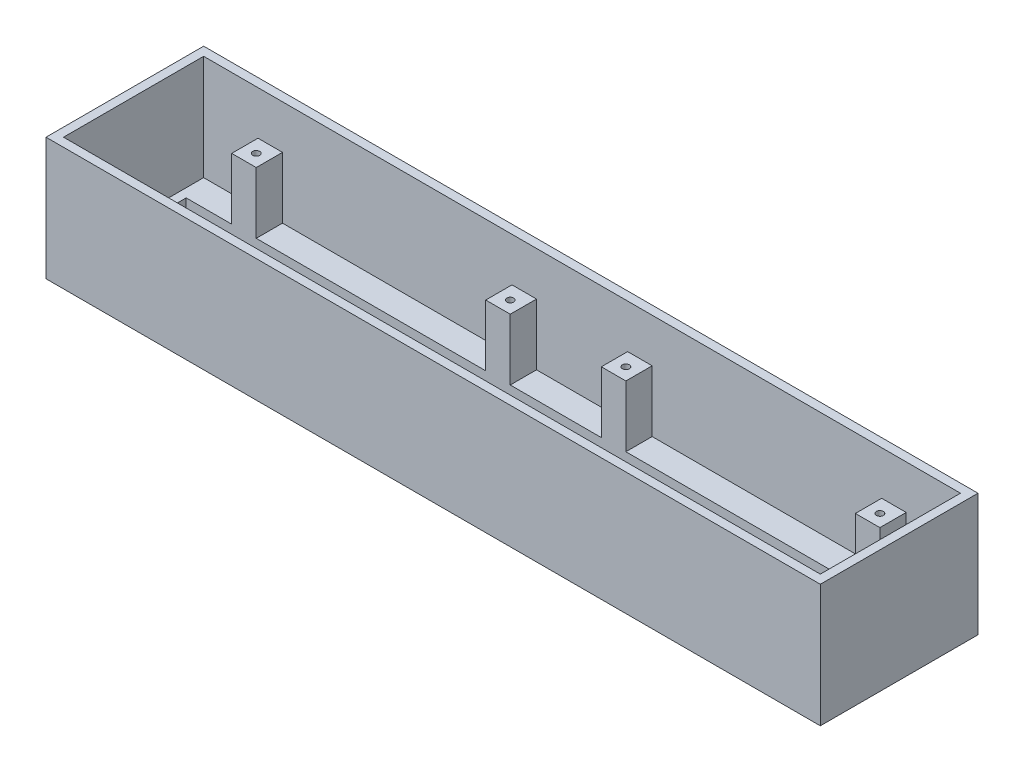
from build123d import *

# Parameters (mm, degrees)
SKETCH1_W           = 221
SKETCH1_H           = 45
BOSS_EXTRUDE1_DEPTH = 5
SKETCH2_W           = 211
SKETCH2_H           = 25
CUT_EXTRUDE1_DEPTH  = 2.5
SKETCH3_R           = 8
CUT_EXTRUDE2_DEPTH  = 2.5
SKETCH6_W           = 221
SKETCH6_H           = 45
SKETCH6_W_2         = 216
SKETCH6_H_2         = 40
BOSS_EXTRUDE3_DEPTH = 30
SKETCH7_W           = 7
SKETCH7_H           = 7.5
BOSS_EXTRUDE4_DEPTH = 17.5
SKETCH9_R           = 1
CUT_EXTRUDE3_DEPTH  = 6


with BuildPart() as part:
    # Sketch1 → Boss-Extrude1 (new body)
    with BuildSketch(Plane(origin=(0, 0, 0), x_dir=(1, 0, 0), z_dir=(0, 1, 0))):
        Rectangle(SKETCH1_W, SKETCH1_H)
    extrude(amount=BOSS_EXTRUDE1_DEPTH)

    # Sketch2 → Cut-Extrude1 (cut)
    with BuildSketch(Plane(origin=(0, 5, 0), x_dir=(1, 0, 0), z_dir=(0, 1, 0))):
        Rectangle(SKETCH2_W, SKETCH2_H)
    extrude(amount=-CUT_EXTRUDE1_DEPTH, mode=Mode.SUBTRACT)

    # Sketch3 → Cut-Extrude2 (cut)
    with BuildSketch(Plane(origin=(0, 2.5, 0), x_dir=(1, 0, 0), z_dir=(0, 1, 0))):
        with Locations(Location((-53, 0, 0), (0, 0, 270))):
            Circle(SKETCH3_R)
        with Locations(Location((53, 0, 0), (0, 0, 270))):
            Circle(SKETCH3_R)
    extrude(amount=-CUT_EXTRUDE2_DEPTH, mode=Mode.SUBTRACT)

    # Sketch6 → Boss-Extrude3 (add)
    with BuildSketch(Plane(origin=(0, 5, 0), x_dir=(1, 0, 0), z_dir=(0, 1, 0))):
        Rectangle(SKETCH6_W, SKETCH6_H)
        Rectangle(SKETCH6_W_2, SKETCH6_H_2, mode=Mode.SUBTRACT)
    extrude(amount=BOSS_EXTRUDE3_DEPTH)

    # Sketch7 → Boss-Extrude4 (add)
    with BuildSketch(Plane(origin=(0, 5, 0), x_dir=(1, 0, 0), z_dir=(0, 1, 0))):
        with Locations((-89, 16.25)):
            Rectangle(SKETCH7_W, SKETCH7_H)
        with Locations((-89, -16.25)):
            Rectangle(SKETCH7_W, SKETCH7_H)
        with Locations((-16.5, 16.25)):
            Rectangle(SKETCH7_W, SKETCH7_H)
        with Locations((-16.5, -16.25)):
            Rectangle(SKETCH7_W, SKETCH7_H)
        with Locations((16.5, 16.25)):
            Rectangle(SKETCH7_W, SKETCH7_H)
        with Locations((16.5, -16.25)):
            Rectangle(SKETCH7_W, SKETCH7_H)
        with Locations((89, 16.25)):
            Rectangle(SKETCH7_W, SKETCH7_H)
        with Locations((89, -16.25)):
            Rectangle(SKETCH7_W, SKETCH7_H)
    extrude(amount=BOSS_EXTRUDE4_DEPTH)

    # Sketch9 → Cut-Extrude3 (cut)
    with BuildSketch(Plane(origin=(0, 22.5, 0), x_dir=(1, 0, 0), z_dir=(0, 1, 0))):
        with Locations(Location((-89, 16, 0), (0, 0, 270))):
            Circle(SKETCH9_R)
        with Locations(Location((-89, -16, 0), (0, 0, 270))):
            Circle(SKETCH9_R)
        with Locations(Location((-16.5, 16, 0), (0, 0, 270))):
            Circle(SKETCH9_R)
        with Locations(Location((-16.5, -16, 0), (0, 0, 270))):
            Circle(SKETCH9_R)
        with Locations(Location((16.5, 16, 0), (0, 0, 270))):
            Circle(SKETCH9_R)
        with Locations(Location((16.5, -16, 0), (0, 0, 270))):
            Circle(SKETCH9_R)
        with Locations(Location((89, 16, 0), (0, 0, 270))):
            Circle(SKETCH9_R)
        with Locations(Location((89, -16, 0), (0, 0, 270))):
            Circle(SKETCH9_R)
    extrude(amount=-CUT_EXTRUDE3_DEPTH, mode=Mode.SUBTRACT)


solid = part.part
